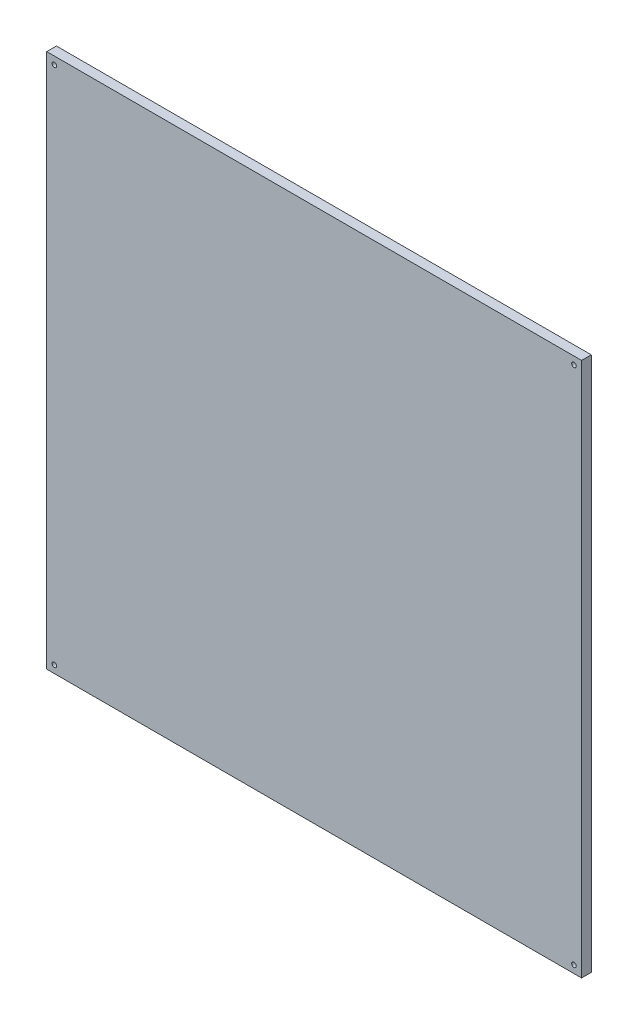
from build123d import *

# Parameters (mm, degrees)
SKETCH1_W           = 350
SKETCH1_H           = 350
BOSS_EXTRUDE1_DEPTH = 6.35
SKETCH2_R           = 1.5
CUT_EXTRUDE1_DEPTH  = 10
CIRPATTERN1_COUNT   = 4


with BuildPart() as part:
    # Sketch1 → Boss-Extrude1 (new body)
    with BuildSketch(Plane.XY):
        with Locations((175, 175)):
            Rectangle(SKETCH1_W, SKETCH1_H)
    extrude(amount=BOSS_EXTRUDE1_DEPTH)

    # Sketch2 → Cut-Extrude1 (cut)
    with BuildSketch(Plane.XY.offset(6.35)):
        with Locations((5, 345)):
            Circle(SKETCH2_R)
    cut_extrude1 = extrude(amount=-CUT_EXTRUDE1_DEPTH, mode=Mode.SUBTRACT)

    # CirPattern1: Cut-Extrude1 ×4 about axis
    cirpattern1_axis = Axis((175.009810029, 174.990189971, 0), (0, 0, 1))
    for i in range(1, CIRPATTERN1_COUNT):
        add(cut_extrude1.rotate(cirpattern1_axis, i * 360 / CIRPATTERN1_COUNT), mode=Mode.SUBTRACT)


solid = part.part
